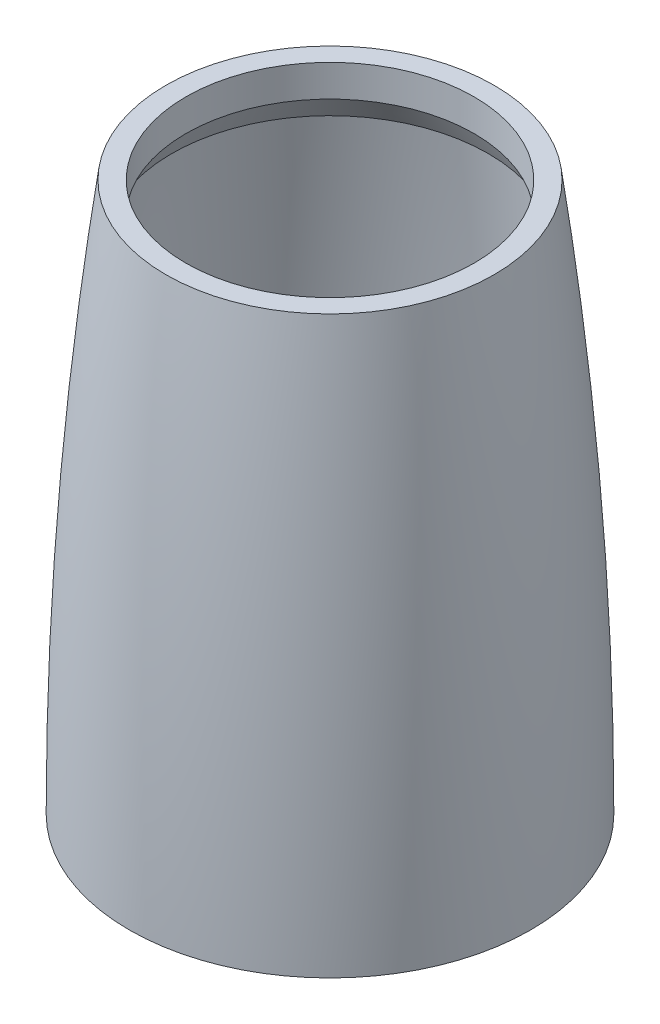
from build123d import *


with BuildPart() as part:
    # Sketch1 → Revolve1 (revolve)
    with BuildSketch(Plane(origin=(0, 0, 0), x_dir=(0, 0, -1), z_dir=(1, 0, 0)), mode=Mode.PRIVATE) as revolve1_sk:
        with BuildLine():
            Line((-41.742956524, 139.7), (-36.662956524, 139.7))
            Line((-36.662956524, 139.7), (-36.662956524, 131.601387737))
            Line((-36.662956524, 131.601387737), (-40.229429126, 125.424075987))
            ThreePointArc((-40.229429126, 125.424075987), (-45.523380739, 68.354124925), (-47.693499866, 11.080258101))
            Line((-47.693499866, 11.080258101), (-45.72, 10.16))
            Line((-45.72, 10.16), (-45.72, 0))
            Line((-45.72, 0), (-51.054, 0))
            ThreePointArc((-51.054, 0), (-48.723659728, 70.004973985), (-41.742956524, 139.7))
        make_face()
    revolve(revolve1_sk.sketch.rotate(Axis((0, 0, 0), (0, 1, 0)), 180), axis=Axis((0, 0, 0), (0, 1, 0)))


solid = part.part
